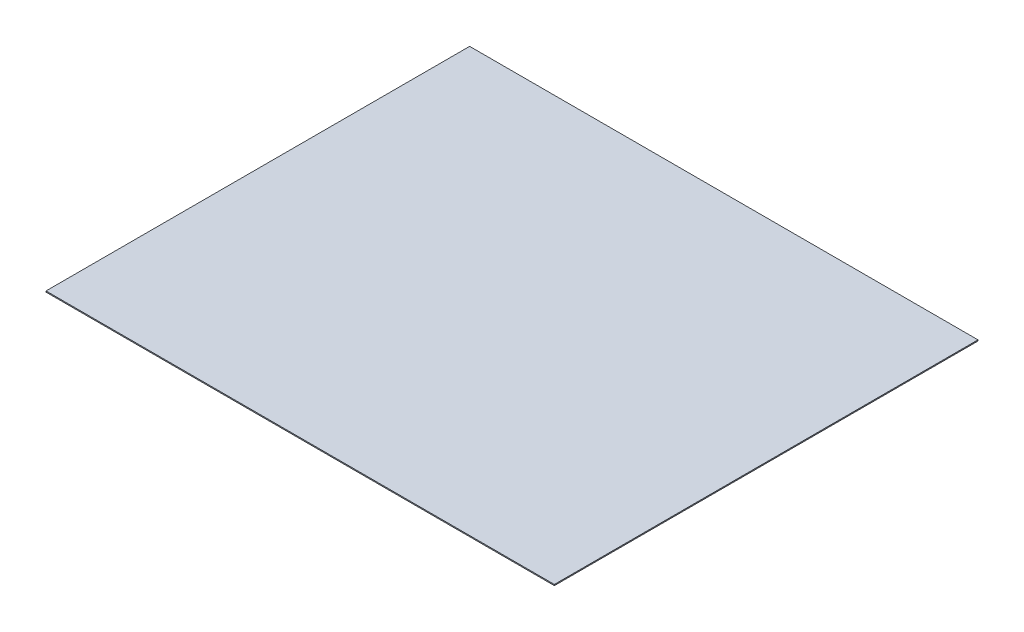
from build123d import *

# Parameters (mm, degrees)
SKETCH1_W           = 2400
SKETCH1_H           = 2000
BOSS_EXTRUDE1_DEPTH = 5


with BuildPart() as part:
    # Sketch1 → Boss-Extrude1 (new body)
    with BuildSketch(Plane(origin=(0, 0, 0), x_dir=(1, 0, 0), z_dir=(0, 1, 0))):
        Rectangle(SKETCH1_W, SKETCH1_H)
    extrude(amount=BOSS_EXTRUDE1_DEPTH)


solid = part.part
